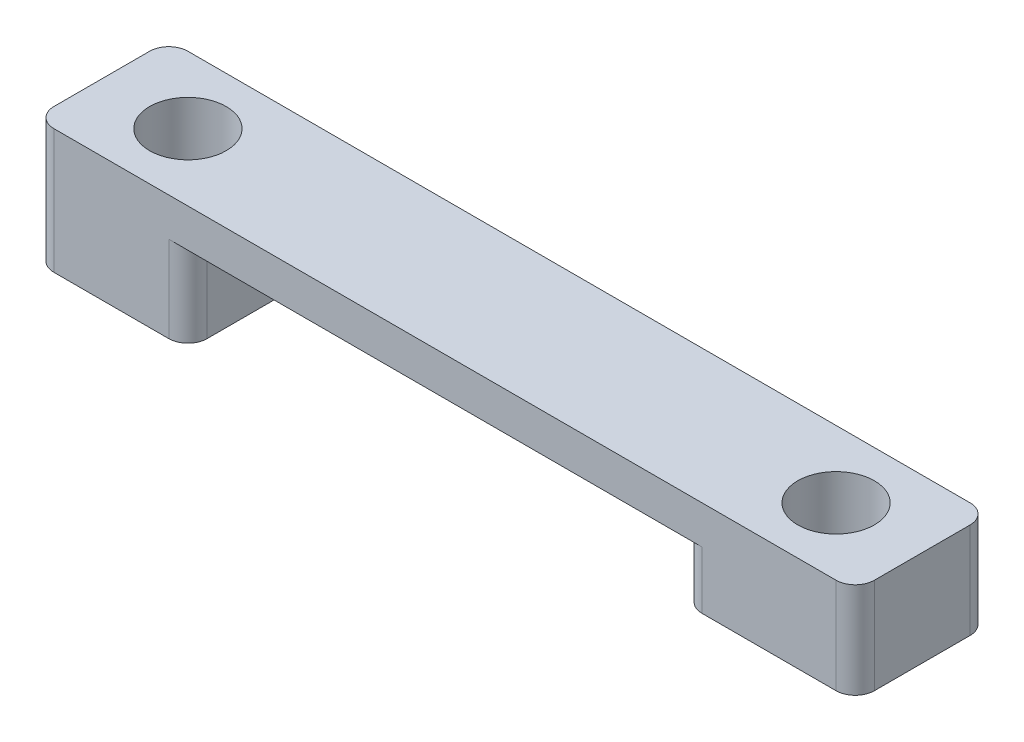
from build123d import *
from build123d.topology import SkipClean

# Parameters (mm, degrees)
SKETCH1_R           = 2
BOSS_EXTRUDE1_DEPTH = 2
BOSS_EXTRUDE2_START = 4.5
SKETCH2_R           = 2
BOSS_EXTRUDE2_DEPTH = 4.5
BOSS_EXTRUDE3_START = 3
SKETCH3_R           = 2
BOSS_EXTRUDE3_DEPTH = 3


with BuildPart() as part:
    # Sketch1 → Boss-Extrude1 (new body)
    with BuildSketch(Plane(origin=(0, 0, 0), x_dir=(1, 0, 0), z_dir=(0, 1, 0))):
        with BuildLine():
            Line((-20.425, -3.5), (20.425, -3.5))
            ThreePointArc((20.425, -3.5), (21.132106781, -3.207106781), (21.425, -2.5))
            Line((21.425, -2.5), (21.425, 2.5))
            ThreePointArc((21.425, 2.5), (21.132106781, 3.207106781), (20.425, 3.5))
            Line((20.425, 3.5), (-20.425, 3.5))
            ThreePointArc((-20.425, 3.5), (-21.132106781, 3.207106781), (-21.425, 2.5))
            Line((-21.425, 2.5), (-21.425, -2.5))
            ThreePointArc((-21.425, -2.5), (-21.132106781, -3.207106781), (-20.425, -3.5))
        make_face()
        with Locations(Location((-16.925, 0, 0), (0, 0, 270))):
            Circle(SKETCH1_R, mode=Mode.SUBTRACT)
        with Locations(Location((16.925, 0, 0), (0, 0, 270))):
            Circle(SKETCH1_R, mode=Mode.SUBTRACT)
    extrude(amount=BOSS_EXTRUDE1_DEPTH)

    # Sketch2 → Boss-Extrude2 (add)
    with SkipClean():  # the faces are left unmerged after this step: merging them gives an invalid solid
        with BuildSketch(Plane.XZ.offset(BOSS_EXTRUDE2_START)):
            with BuildLine():
                Line((-14.425, -3.5), (-20.425, -3.5))
                ThreePointArc((-20.425, -3.5), (-21.132106781, -3.207106781), (-21.425, -2.5))
                Line((-21.425, -2.5), (-21.425, 2.5))
                ThreePointArc((-21.425, 2.5), (-21.132106781, 3.207106781), (-20.425, 3.5))
                Line((-20.425, 3.5), (-14.425, 3.5))
                ThreePointArc((-14.425, 3.5), (-13.717893219, 3.207106781), (-13.425, 2.5))
                Line((-13.425, 2.5), (-13.425, -2.5))
                ThreePointArc((-13.425, -2.5), (-13.717893219, -3.207106781), (-14.425, -3.5))
            make_face()
            with Locations(Location((-16.925, 0, 0), (0, 0, 270))):
                Circle(SKETCH2_R, mode=Mode.SUBTRACT)
        extrude(amount=-BOSS_EXTRUDE2_DEPTH)

    # Sketch3 → Boss-Extrude3 (add)
    with SkipClean():  # the faces are left unmerged after this step: merging them gives an invalid solid
        with BuildSketch(Plane.XZ.offset(BOSS_EXTRUDE3_START)):
            with BuildLine():
                Line((13.425, 3.5), (20.425, 3.5))
                ThreePointArc((20.425, 3.5), (21.132106781, 3.207106781), (21.425, 2.5))
                Line((21.425, 2.5), (21.425, -2.5))
                ThreePointArc((21.425, -2.5), (21.132106781, -3.207106781), (20.425, -3.5))
                Line((20.425, -3.5), (13.425, -3.5))
                ThreePointArc((13.425, -3.5), (12.717893219, -3.207106781), (12.425, -2.5))
                Line((12.425, -2.5), (12.425, 2.5))
                ThreePointArc((12.425, 2.5), (12.717893219, 3.207106781), (13.425, 3.5))
            make_face()
            with Locations(Location((16.925, 0, 0), (0, 0, 270))):
                Circle(SKETCH3_R, mode=Mode.SUBTRACT)
        extrude(amount=-BOSS_EXTRUDE3_DEPTH)


solid = part.part
